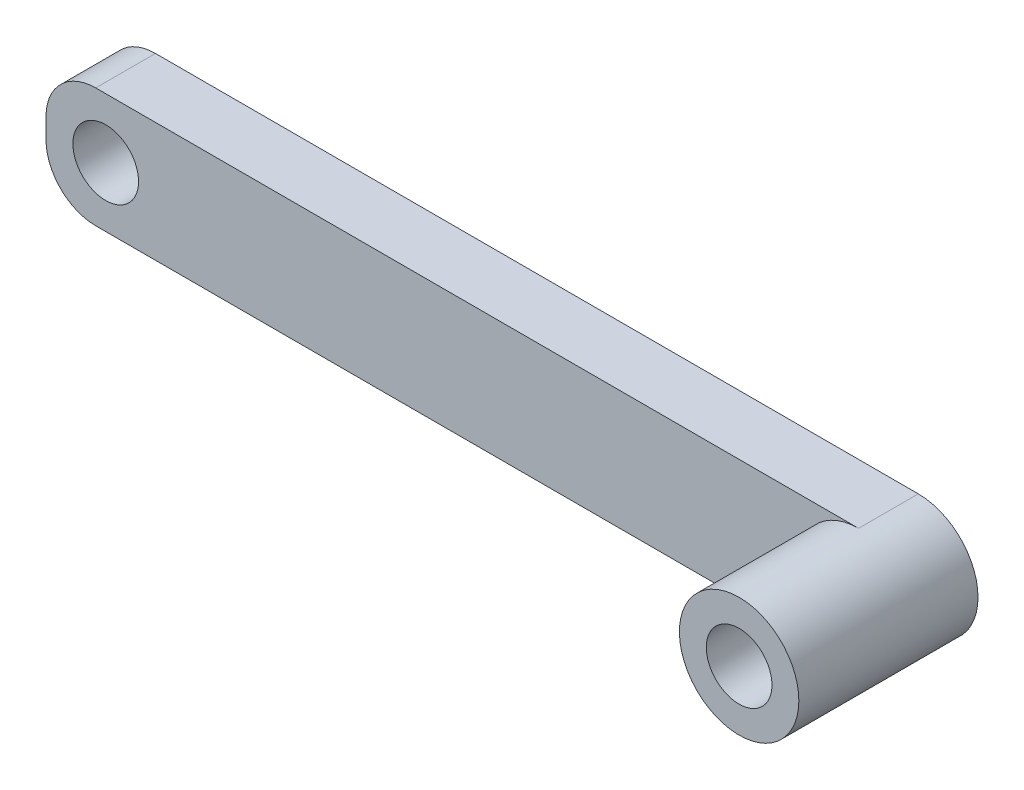
from build123d import *

# Parameters (mm, degrees)
SKETCH1_R           = 1.65
BOSS_EXTRUDE1_DEPTH = 3
SKETCH1_3_R         = 3
SKETCH1_3_R_2       = 1.65
BOSS_EXTRUDE2_DEPTH = 9
FILLET1_R           = 2.5


with BuildPart() as part:
    # Sketch1 → Boss-Extrude1 (new body)
    with BuildSketch(Plane.XY):
        with BuildLine():
            Line((-21.91, -3), (18.91, -3))
            ThreePointArc((18.91, -3), (15.91, 0), (18.91, 3))
            Line((18.91, 3), (-21.91, 3))
            Line((-21.91, 3), (-21.91, -3))
        make_face()
        with Locations((-18.91, 0)):
            Circle(SKETCH1_R, mode=Mode.SUBTRACT)
    extrude(amount=BOSS_EXTRUDE1_DEPTH)

    # Sketch1<3> → Boss-Extrude2 (add)
    with BuildSketch(Plane.XY):
        with Locations((18.91, 0)):
            Circle(SKETCH1_3_R)
        with Locations((18.91, 0)):
            Circle(SKETCH1_3_R_2, mode=Mode.SUBTRACT)
    extrude(amount=BOSS_EXTRUDE2_DEPTH)

    # Fillet1
    fillet1_edges = [part.edges().sort_by_distance(p)[0] for p in [
        (-21.91, -3, 1.5),
        (-21.91, 3, 1.5),
    ]]
    fillet(fillet1_edges, radius=FILLET1_R)


solid = part.part
